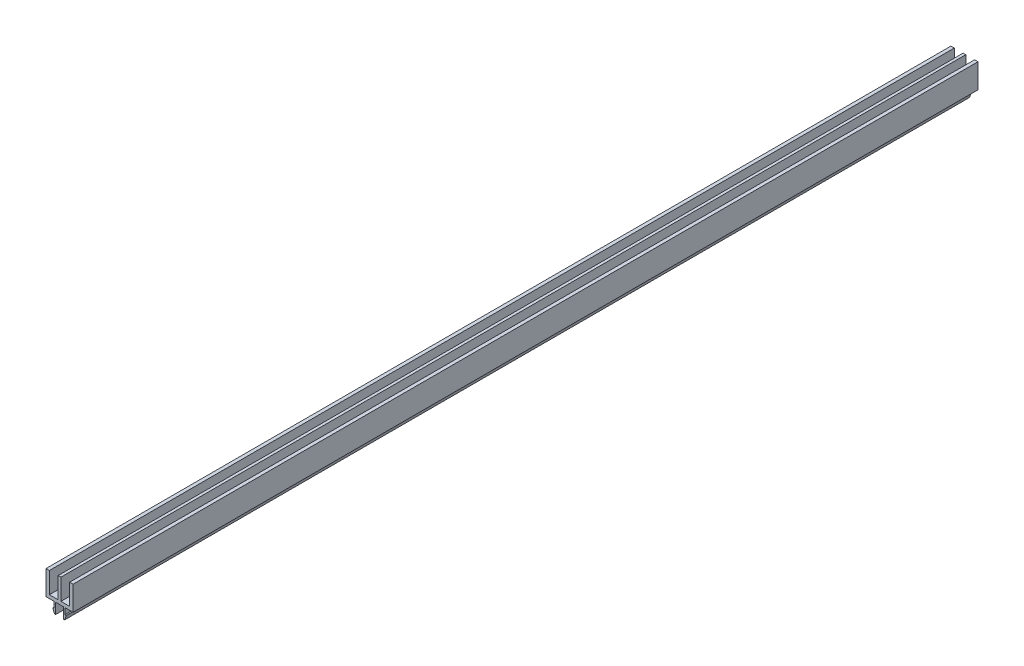
from build123d import *

# Parameters (mm, degrees)
BOSS_EXTRU_1_DEPTH = 668


with BuildPart() as part:
    # Esquisse1 → Boss.-Extru.1 (new body)
    with BuildSketch(Plane.XY.offset(50)):
        Polygon((-1, 2.5), (-7.5, 2.5), (-7.5, 17.999999998), (-10, 17.999999998), (-10, 0), (-4, 0), (-4, -4.5), (-5, -4.5), (-3.75, -8), (-3, -8), (-3, 0), (3, 0), (3, -8), (3.75, -8), (5, -4.5), (4, -4.5), (4, 0), (10, 0), (10, 17.999999998), (7.5, 17.999999998), (7.5, 2.5), (1, 2.5), (1, 17.999999998), (-1, 17.999999998), align=None)
    extrude(amount=-BOSS_EXTRU_1_DEPTH)


solid = part.part
